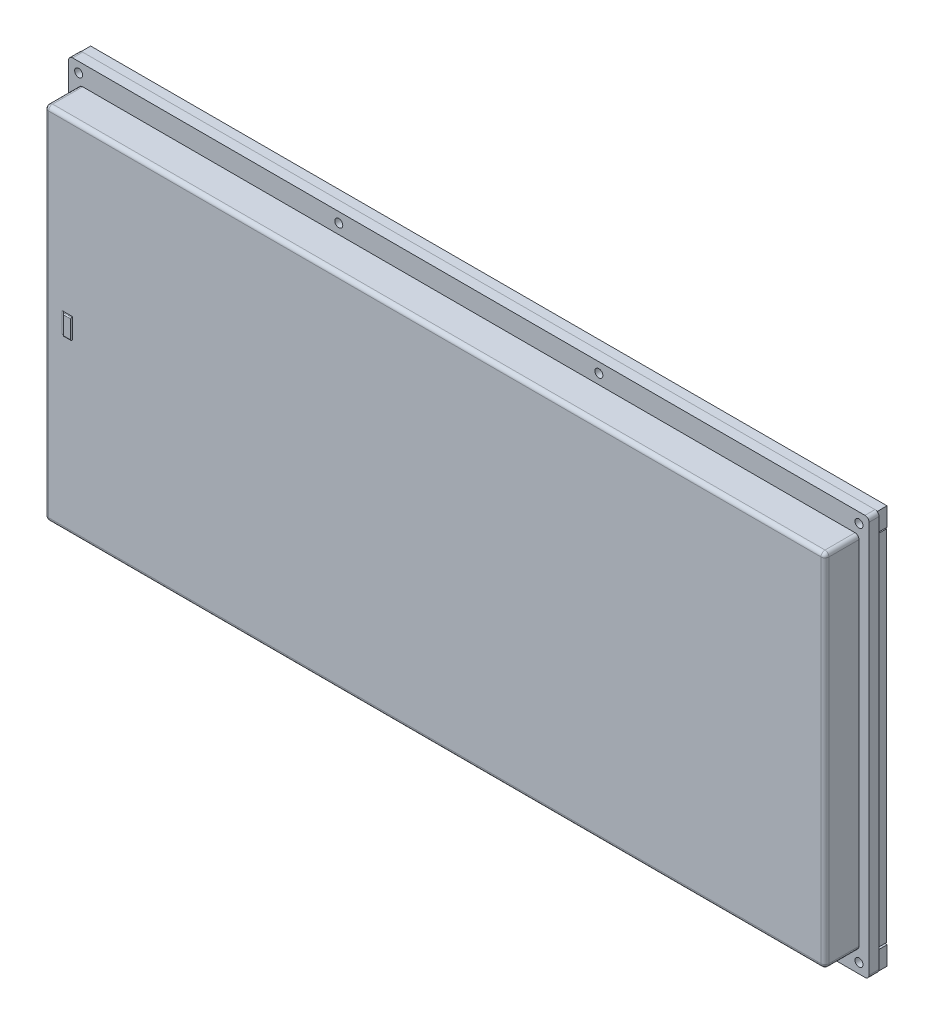
from build123d import *

# Parameters (mm, degrees)
IZIM1_R                       = 2
Y_KSEKLIK_EKSTR_ZYON1_DEPTH   = 5
IZIM3_W                       = 390
IZIM3_H                       = 180
Y_KSEKLIK_EKSTR_ZYON2_DEPTH   = 17
RADYUS1_R                     = 2
Y_KSEKLIK_EKSTR_ZYON3_DEPTH   = 5
RADYUS2_R                     = 0.5
IZIM8_W                       = 199
IZIM8_H                       = 9.3
IZIM8_R                       = 2.7
Y_KSEKLIK_EKSTR_ZYON4_DEPTH   = 5
IZIM9_W                       = 7.5
IZIM9_H                       = 179.1
Y_KSEKLIK_EKSTR_ZYON5_DEPTH   = 5
IZIM10_R                      = 2
KES_EKSTR_ZYON1_DEPTH         = 5
Y_KSEKLIK_EKSTR_ZYON7_DEPTH   = 2
Y_KSEKLIK_EKSTR_ZYON7_2_DEPTH = 2


with BuildPart() as part:
    # Çizim1 → Yükseklik-Ekstrüzyon1 (new body)
    with BuildSketch(Plane.XY):
        with BuildLine():
            Line((-198, -100), (198, -100))
            ThreePointArc((198, -100), (199.414213562, -99.414213562), (200, -98))
            Line((200, -98), (200, 98))
            ThreePointArc((200, 98), (199.414213562, 99.414213562), (198, 100))
            Line((198, 100), (-198, 100))
            ThreePointArc((-198, 100), (-199.414213562, 99.414213562), (-200, 98))
            Line((-200, 98), (-200, -98))
            ThreePointArc((-200, -98), (-199.414213562, -99.414213562), (-198, -100))
        make_face()
        with Locations((-195, 95)):
            Circle(IZIM1_R, mode=Mode.SUBTRACT)
        with Locations((-65, 95)):
            Circle(IZIM1_R, mode=Mode.SUBTRACT)
        with Locations((65, 95)):
            Circle(IZIM1_R, mode=Mode.SUBTRACT)
        with Locations((195, 95)):
            Circle(IZIM1_R, mode=Mode.SUBTRACT)
        with Locations(Location((195, -95, 0), (0, 0, 180))):
            Circle(IZIM1_R, mode=Mode.SUBTRACT)
        with Locations(Location((65, -95, 0), (0, 0, 180))):
            Circle(IZIM1_R, mode=Mode.SUBTRACT)
        with Locations(Location((-65, -95, 0), (0, 0, 180))):
            Circle(IZIM1_R, mode=Mode.SUBTRACT)
        with Locations(Location((-195, -95, 0), (0, 0, 180))):
            Circle(IZIM1_R, mode=Mode.SUBTRACT)
    extrude(amount=Y_KSEKLIK_EKSTR_ZYON1_DEPTH)


with BuildPart() as body_2:
    # Çizim3 → Yükseklik-Ekstrüzyon2 (new body)
    with BuildSketch(Plane.XY.offset(5)):
        Rectangle(IZIM3_W, IZIM3_H)
    extrude(amount=Y_KSEKLIK_EKSTR_ZYON2_DEPTH)

    # Radyus1
    radyus1_edges = [body_2.edges().sort_by_distance(p)[0] for p in [
        (-195, 0, 22),
        (0, -90, 22),
        (195, 0, 22),
        (195, -90, 13.5),
        (-195, -90, 13.5),
        (-195, 90, 13.5),
        (195, 90, 13.5),
        (0, 90, 22),
    ]]
    fillet(radyus1_edges, radius=RADYUS1_R)


with BuildPart() as body_3:
    # Çizim7 → Yükseklik-Ekstrüzyon3 (new, symmetric)
    with BuildSketch(Plane(origin=(0, 0, 0), x_dir=(1, 0, 0), z_dir=(0, 1, 0))):
        with BuildLine():
            Line((-184.5, -23), (-181, -23))
            Line((-181, -23), (-181, -22))
            Line((-181, -22), (-186.443927913, -22))
            ThreePointArc((-186.443927913, -22), (-185.350898209, -22.264656915), (-184.5, -23))
        make_face()
    extrude(amount=Y_KSEKLIK_EKSTR_ZYON3_DEPTH, both=True)

    # Radyus2
    radyus2_edges = [body_3.edges().sort_by_distance(p)[0] for p in [
        (-182.75, -5, 23),
        (-182.75, 5, 23),
    ]]
    fillet(radyus2_edges, radius=RADYUS2_R)


with BuildPart() as body_4:
    # Çizim8 → Yükseklik-Ekstrüzyon4 (new body)
    # profile 1 of 2: a face of its own
    with BuildSketch(Plane.XY):
        with Locations((-99.5, -95)):
            Rectangle(IZIM8_W, IZIM8_H)
        with Locations(Location((-195, -95, 0), (0, 0, 180))):
            Circle(IZIM8_R, mode=Mode.SUBTRACT)
        with Locations(Location((-65, -95, 0), (0, 0, 180))):
            Circle(IZIM8_R, mode=Mode.SUBTRACT)
    # profile 2 of 2: a face of its own
    with BuildSketch(Plane.XY):
        with Locations((99.5, -95)):
            Rectangle(IZIM8_W, IZIM8_H)
        with Locations(Location((65, -95, 0), (0, 0, 180))):
            Circle(IZIM8_R, mode=Mode.SUBTRACT)
        with Locations(Location((195, -95, 0), (0, 0, 180))):
            Circle(IZIM8_R, mode=Mode.SUBTRACT)
    y_kseklik_ekstr_zyon4 = extrude(amount=-Y_KSEKLIK_EKSTR_ZYON4_DEPTH)


with BuildPart() as part_1:
    add(part.part)

    # Aynalama1: Yükseklik-Ekstrüzyon4 across plane
    add(y_kseklik_ekstr_zyon4.mirror(Plane.ZX))

    # Çizim9 → Yükseklik-Ekstrüzyon5 (add)
    with BuildSketch(Plane(origin=(0, 0, 0), x_dir=(-1, 0, 0), z_dir=(0, 0, -1))):
        with Locations((-195, 0)):
            Rectangle(IZIM9_W, IZIM9_H)
    y_kseklik_ekstr_zyon5 = extrude(amount=Y_KSEKLIK_EKSTR_ZYON5_DEPTH)

    # Aynalama2: Yükseklik-Ekstrüzyon5 across plane
    add(y_kseklik_ekstr_zyon5.mirror(Plane(origin=(0, 0, 0), x_dir=(0, 0, 1), z_dir=(1, 0, 0))))

    # Çizim10 → Kes-Ekstrüzyon1 (cut)
    with BuildSketch(Plane(origin=(0, 0, 0), x_dir=(-1, 0, 0), z_dir=(0, 0, -1))):
        with Locations((-187.31, -82.76)):
            Circle(IZIM10_R)
        with Locations((-65.81, -82.76)):
            Circle(IZIM10_R)
        with Locations((55.69, -82.76)):
            Circle(IZIM10_R)
        with Locations((177.19, -82.76)):
            Circle(IZIM10_R)
        with Locations((177.19, 82.76)):
            Circle(IZIM10_R)
        with Locations((55.69, 82.76)):
            Circle(IZIM10_R)
        with Locations((-65.81, 82.76)):
            Circle(IZIM10_R)
        with Locations((-187.31, 82.76)):
            Circle(IZIM10_R)
    extrude(amount=-KES_EKSTR_ZYON1_DEPTH, mode=Mode.SUBTRACT)


with BuildPart() as body_5:
    # Çizim12 → Yükseklik-Ekstrüzyon7 (new body)
    with BuildSketch(Plane(origin=(0, 0, 0), x_dir=(-1, 0, 0), z_dir=(0, 0, -1))):
        with BuildLine():
            Line((-176.25, 89.76), (44.63, 89.76))
            ThreePointArc((44.63, 89.76), (46.044213562, 89.174213562), (46.63, 87.76))
            Line((46.63, 87.76), (46.63, 86.178506215))
            ThreePointArc((46.63, 86.178506215), (47.801572875, 83.350079091), (50.63, 82.178506215))
            Line((50.63, 82.178506215), (51.13, 82.178506215))
            ThreePointArc((51.13, 82.178506215), (51.837106781, 81.885612997), (52.13, 81.178506215))
            Line((52.13, 81.178506215), (52.13, -81.178506215))
            ThreePointArc((52.13, -81.178506215), (51.837106781, -81.885612997), (51.13, -82.178506215))
            Line((51.13, -82.178506215), (50.63, -82.178506215))
            ThreePointArc((50.63, -82.178506215), (47.801572875, -83.350079091), (46.63, -86.178506215))
            Line((46.63, -86.178506215), (46.63, -87.76))
            ThreePointArc((46.63, -87.76), (46.044213562, -89.174213562), (44.63, -89.76))
            Line((44.63, -89.76), (-58.81, -89.76))
            ThreePointArc((-58.81, -89.76), (-60.224213562, -89.174213562), (-60.81, -87.76))
            Line((-60.81, -87.76), (-60.81, -82.76))
            ThreePointArc((-60.81, -82.76), (-62.274466094, -79.224466094), (-65.81, -77.76))
            ThreePointArc((-65.81, -77.76), (-69.345533906, -79.224466094), (-70.81, -82.76))
            Line((-70.81, -82.76), (-70.81, -87.76))
            ThreePointArc((-70.81, -87.76), (-71.395786438, -89.174213562), (-72.81, -89.76))
            Line((-72.81, -89.76), (-176.25, -89.76))
            ThreePointArc((-176.25, -89.76), (-177.664213562, -89.174213562), (-178.25, -87.76))
            Line((-178.25, -87.76), (-178.25, -86.178506215))
            ThreePointArc((-178.25, -86.178506215), (-179.421572875, -83.350079091), (-182.25, -82.178506215))
            Line((-182.25, -82.178506215), (-182.75, -82.178506215))
            ThreePointArc((-182.75, -82.178506215), (-183.457106781, -81.885612997), (-183.75, -81.178506215))
            Line((-183.75, -81.178506215), (-183.75, 81.178506215))
            ThreePointArc((-183.75, 81.178506215), (-183.457106781, 81.885612997), (-182.75, 82.178506215))
            Line((-182.75, 82.178506215), (-182.25, 82.178506215))
            ThreePointArc((-182.25, 82.178506215), (-179.421572875, 83.350079091), (-178.25, 86.178506215))
            Line((-178.25, 86.178506215), (-178.25, 87.76))
            ThreePointArc((-178.25, 87.76), (-177.664213562, 89.174213562), (-176.25, 89.76))
        make_face()
    extrude(amount=Y_KSEKLIK_EKSTR_ZYON7_DEPTH)


with BuildPart() as body_6:
    # Çizim12 → Y_kseklik-Ekstr_zyon7 2 (new body)
    with BuildSketch(Plane(origin=(0, 0, 0), x_dir=(-1, 0, 0), z_dir=(0, 0, -1))):
        with BuildLine():
            Line((63.63, -87.76), (63.63, -86.178506215))
            ThreePointArc((63.63, -86.178506215), (62.458427125, -83.350079091), (59.63, -82.178506215))
            Line((59.63, -82.178506215), (59.13, -82.178506215))
            ThreePointArc((59.13, -82.178506215), (58.422893219, -81.885612997), (58.13, -81.178506215))
            Line((58.13, -81.178506215), (58.13, 81.178506215))
            ThreePointArc((58.13, 81.178506215), (58.422893219, 81.885612997), (59.13, 82.178506215))
            Line((59.13, 82.178506215), (59.63, 82.178506215))
            ThreePointArc((59.63, 82.178506215), (62.458427125, 83.350079091), (63.63, 86.178506215))
            Line((63.63, 86.178506215), (63.63, 87.76))
            ThreePointArc((63.63, 87.76), (64.215786438, 89.174213562), (65.63, 89.76))
            Line((65.63, 89.76), (166.63, 89.76))
            ThreePointArc((166.63, 89.76), (168.044213562, 89.174213562), (168.63, 87.76))
            Line((168.63, 87.76), (168.63, 86.178506215))
            ThreePointArc((168.63, 86.178506215), (169.801572875, 83.350079091), (172.63, 82.178506215))
            Line((172.63, 82.178506215), (173.13, 82.178506215))
            ThreePointArc((173.13, 82.178506215), (173.837106781, 81.885612997), (174.13, 81.178506215))
            Line((174.13, 81.178506215), (174.13, -81.178506215))
            ThreePointArc((174.13, -81.178506215), (173.837106781, -81.885612997), (173.13, -82.178506215))
            Line((173.13, -82.178506215), (172.63, -82.178506215))
            ThreePointArc((172.63, -82.178506215), (169.801572875, -83.350079091), (168.63, -86.178506215))
            Line((168.63, -86.178506215), (168.63, -87.76))
            ThreePointArc((168.63, -87.76), (168.044213562, -89.174213562), (166.63, -89.76))
            Line((166.63, -89.76), (65.63, -89.76))
            ThreePointArc((65.63, -89.76), (64.215786438, -89.174213562), (63.63, -87.76))
        make_face()
    extrude(amount=Y_KSEKLIK_EKSTR_ZYON7_2_DEPTH)


solid = Compound([body_2.part, body_3.part, body_4.part, part_1.part, body_5.part, body_6.part])
